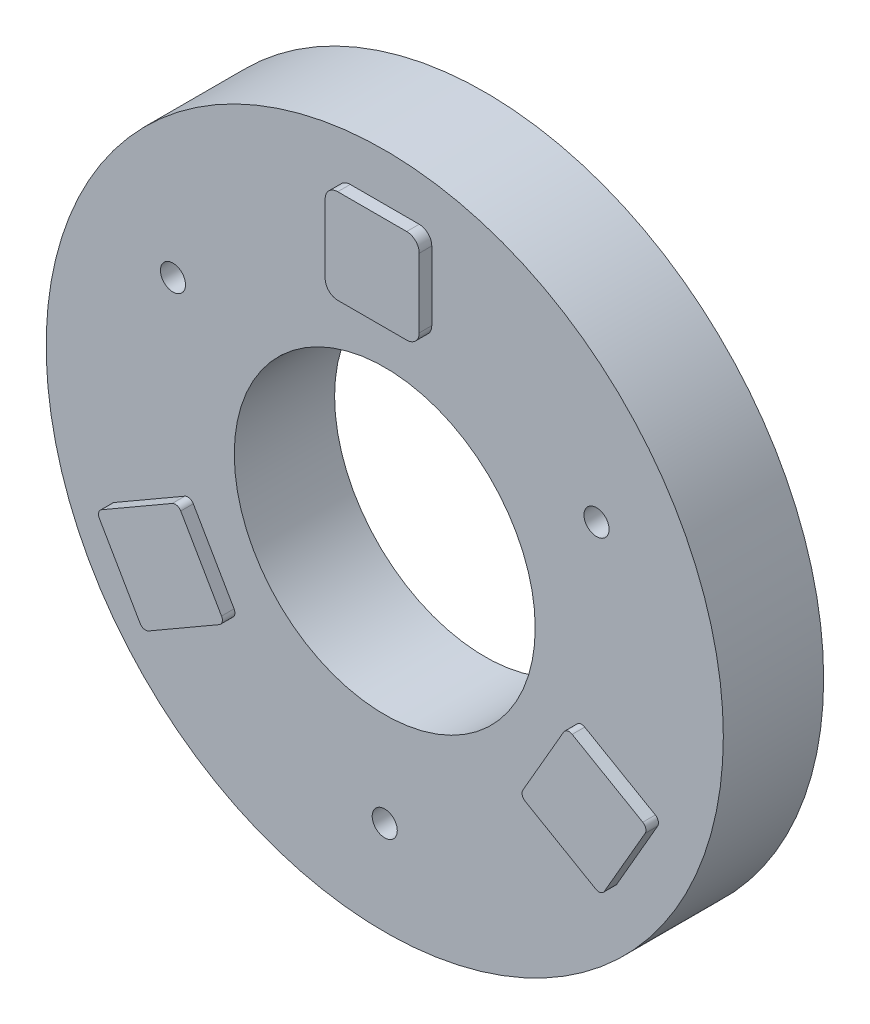
from build123d import *

# Parameters (mm, degrees)
SKETCH2_R           = 13.5
SKETCH2_R_2         = 6
SKETCH2_R_3         = 0.5
BOSS_EXTRUDE2_DEPTH = 2
BOSS_EXTRUDE3_DEPTH = 2.5


with BuildPart() as part:
    # Sketch2 → Boss-Extrude2 (new, symmetric)
    with BuildSketch(Plane.XY):
        Circle(SKETCH2_R)
        Circle(SKETCH2_R_2, mode=Mode.SUBTRACT)
        with Locations((8.443747687, 4.875)):
            Circle(SKETCH2_R_3, mode=Mode.SUBTRACT)
        with Locations((0, -9.75)):
            Circle(SKETCH2_R_3, mode=Mode.SUBTRACT)
        with Locations((-8.443747687, 4.875)):
            Circle(SKETCH2_R_3, mode=Mode.SUBTRACT)
    extrude(amount=BOSS_EXTRUDE2_DEPTH, both=True)

    # Sketch3 → Boss-Extrude3 (add, symmetric)
    with BuildSketch(Plane.XY):
        with BuildLine():
            Line((7.632450055, -2.530208719), (6.007450055, -5.344791281))
            ThreePointArc((6.007450055, -5.344791281), (5.982474949, -5.534496042), (6.098956406, -5.686297632))
            Line((6.098956406, -5.686297632), (8.913538968, -7.311297632))
            ThreePointArc((8.913538968, -7.311297632), (9.103243729, -7.336272738), (9.255045319, -7.219791281))
            Line((9.255045319, -7.219791281), (10.880045319, -4.405208719))
            ThreePointArc((10.880045319, -4.405208719), (10.905020425, -4.215503958), (10.788538968, -4.063702368))
            Line((10.788538968, -4.063702368), (7.973956406, -2.438702368))
            ThreePointArc((7.973956406, -2.438702368), (7.784251644, -2.413727262), (7.632450055, -2.530208719))
        make_face()
        with BuildLine():
            Line((-1.375, 7.875), (1.375, 7.875))
            ThreePointArc((1.375, 7.875), (1.728553391, 8.021446609), (1.875, 8.375))
            Line((1.875, 8.375), (1.875, 11.125))
            ThreePointArc((1.875, 11.125), (1.728553391, 11.478553391), (1.375, 11.625))
            Line((1.375, 11.625), (-1.375, 11.625))
            ThreePointArc((-1.375, 11.625), (-1.728553391, 11.478553391), (-1.875, 11.125))
            Line((-1.875, 11.125), (-1.875, 8.375))
            ThreePointArc((-1.875, 8.375), (-1.728553391, 8.021446609), (-1.375, 7.875))
        make_face()
        with BuildLine():
            Line((-6.007450055, -5.344791281), (-7.632450055, -2.530208719))
            ThreePointArc((-7.632450055, -2.530208719), (-7.784251644, -2.413727262), (-7.973956406, -2.438702368))
            Line((-7.973956406, -2.438702368), (-10.788538968, -4.063702368))
            ThreePointArc((-10.788538968, -4.063702368), (-10.905020425, -4.215503958), (-10.880045319, -4.405208719))
            Line((-10.880045319, -4.405208719), (-9.255045319, -7.219791281))
            ThreePointArc((-9.255045319, -7.219791281), (-9.103243729, -7.336272738), (-8.913538968, -7.311297632))
            Line((-8.913538968, -7.311297632), (-6.098956406, -5.686297632))
            ThreePointArc((-6.098956406, -5.686297632), (-5.982474949, -5.534496042), (-6.007450055, -5.344791281))
        make_face()
    extrude(amount=BOSS_EXTRUDE3_DEPTH, both=True)


solid = part.part
